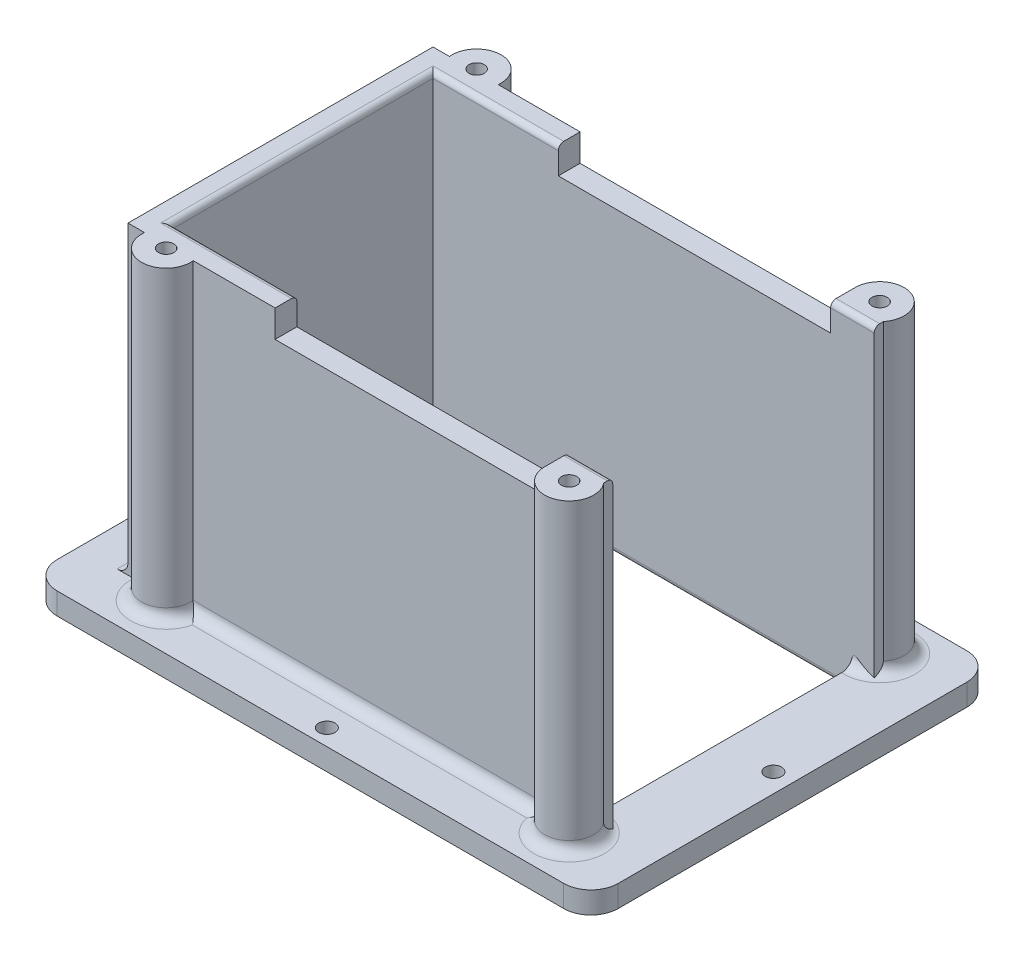
from build123d import *

# Parameters (mm, degrees)
SKETCH_1_W               = 103
SKETCH_1_H               = 74
EXTRUDE_1_DEPTH          = 4
SKETCH_2_W               = 85
SKETCH_2_H               = 56
EXTRUDE_2_DEPTH          = 56
SKETCH_3_W               = 81
SKETCH_3_H               = 48
CUT_EXTRUDE_1_DEPTH      = 56
SKETCH_7_R               = 4.5
EXTRUDE_3_DEPTH          = 56
SKETCH_8_R               = 1.4
CUT_EXTRUDE_4_DEPTH      = 88.299770905
SKETCH_4_R               = 1.5
CUT_EXTRUDE_2_DEPTH      = 85.600531913
SKETCH_5_W               = 77
SKETCH_5_H               = 48
CUT_EXTRUDE_3_DEPTH      = 26
FILLET_8_R               = 2
FILLET_7_R               = 1
CUT_EXTRUDE_5_DEPTH      = 88.299770973
CUT_EXTRUDE_5_DEPTH_BACK = 88.299770973
SKETCH_9_W               = 50
SKETCH_9_H               = 5
FILLET_9_R               = 5


with BuildPart() as part:
    # 草图1 → 凸台-拉伸1 (new body)
    with BuildSketch(Plane(origin=(0, 0, 0), x_dir=(1, 0, 0), z_dir=(0, 1, 0))):
        Rectangle(SKETCH_1_W, SKETCH_1_H)
    extrude(amount=EXTRUDE_1_DEPTH)

    # 草图2 → 凸台-拉伸2 (add)
    with BuildSketch(Plane(origin=(0, 4, 0), x_dir=(1, 0, 0), z_dir=(0, 1, 0))):
        Rectangle(SKETCH_2_W, SKETCH_2_H)
    extrude(amount=EXTRUDE_2_DEPTH)

    # 草图3 → 切除-拉伸1 (cut)
    with BuildSketch(Plane(origin=(0, 60, 0), x_dir=(1, 0, 0), z_dir=(0, 1, 0))):
        with Locations((2, 0)):
            Rectangle(SKETCH_3_W, SKETCH_3_H)
    extrude(amount=-CUT_EXTRUDE_1_DEPTH, mode=Mode.SUBTRACT)

    # 草图7 → 凸台-拉伸3 (add)
    with BuildSketch(Plane(origin=(0, 4, 0), x_dir=(1, 0, 0), z_dir=(0, 1, 0))):
        with Locations((-35, 28.5)):
            Circle(SKETCH_7_R)
        with Locations((39, 28.5)):
            Circle(SKETCH_7_R)
        with Locations((39, -28.5)):
            Circle(SKETCH_7_R)
        with Locations((-35, -28.5)):
            Circle(SKETCH_7_R)
    extrude(amount=EXTRUDE_3_DEPTH)

    # 草图8 → 切除-拉伸4 (cut, through all)
    with BuildSketch(Plane(origin=(0, 60, 0), x_dir=(1, 0, 0), z_dir=(0, 1, 0))):
        with Locations(Location((-35, 28.5, 0), (0, 0, 270))):
            Circle(SKETCH_8_R)
        with Locations(Location((39, 28.5, 0), (0, 0, 270))):
            Circle(SKETCH_8_R)
        with Locations(Location((-35, -28.5, 0), (0, 0, 270))):
            Circle(SKETCH_8_R)
        with Locations(Location((39, -28.5, 0), (0, 0, 270))):
            Circle(SKETCH_8_R)
    extrude(amount=-CUT_EXTRUDE_4_DEPTH, mode=Mode.SUBTRACT)

    # 草图4 → 切除-拉伸2 (cut, through all)
    with BuildSketch(Plane(origin=(0, 4, 0), x_dir=(1, 0, 0), z_dir=(0, 1, 0))):
        with Locations(Location((-48, 0, 0), (0, 0, 270))):
            Circle(SKETCH_4_R)
        with Locations(Location((48, 0, 0), (0, 0, 90))):
            Circle(SKETCH_4_R)
        with Locations(Location((0, 34, 0), (0, 0, 270))):
            Circle(SKETCH_4_R)
        with Locations(Location((0, -34, 0), (0, 0, 90))):
            Circle(SKETCH_4_R)
    extrude(amount=-CUT_EXTRUDE_2_DEPTH, mode=Mode.SUBTRACT)

    # 草图5 → 切除-拉伸3 (cut)
    with BuildSketch(Plane(origin=(0, 4, 0), x_dir=(1, 0, 0), z_dir=(0, 1, 0))):
        Rectangle(SKETCH_5_W, SKETCH_5_H)
    extrude(amount=-CUT_EXTRUDE_3_DEPTH, mode=Mode.SUBTRACT)

    # 圆角8
    fillet_8_edges = [part.edges().sort_by_distance(p)[0] for p in [
        (40.261608219, 4, -32.819530611),
        (2, 4, -28),
        (-35, 4, -33),
        (-40.986067977, 4, -28),
        (-42.5, 4, 0),
        (-35, 4, 33),
        (40.261608219, 4, 32.819530611),
        (2, 4, 28),
    ]]
    fillet(fillet_8_edges, radius=FILLET_8_R)

    # 圆角7
    fillet_7_edges = [part.edges().sort_by_distance(p)[0] for p in [
        (0, 0, -24),
        (-38.5, 0, 0),
        (38.5, 0, 0),
        (0, 0, 24),
        (2, 60, -24),
        (-38.5, 60, 0),
        (2, 60, 24),
    ]]
    fillet(fillet_7_edges, radius=FILLET_7_R)

    # 草图9 → 切除-拉伸5 (cut, two sides: drawn at the far end of the back side and taken through both)
    with BuildSketch(Plane.XY.offset(-CUT_EXTRUDE_5_DEPTH_BACK)):
        with Locations((9.5, 57.5)):
            Rectangle(SKETCH_9_W, SKETCH_9_H)
    extrude(amount=CUT_EXTRUDE_5_DEPTH + CUT_EXTRUDE_5_DEPTH_BACK, mode=Mode.SUBTRACT)

    # 圆角9
    fillet_9_edges = [part.edges().sort_by_distance(p)[0] for p in [
        (51.5, 2, 37),
        (-51.5, 2, 37),
        (-51.5, 2, -37),
        (51.5, 2, -37),
    ]]
    fillet(fillet_9_edges, radius=FILLET_9_R)


solid = part.part
